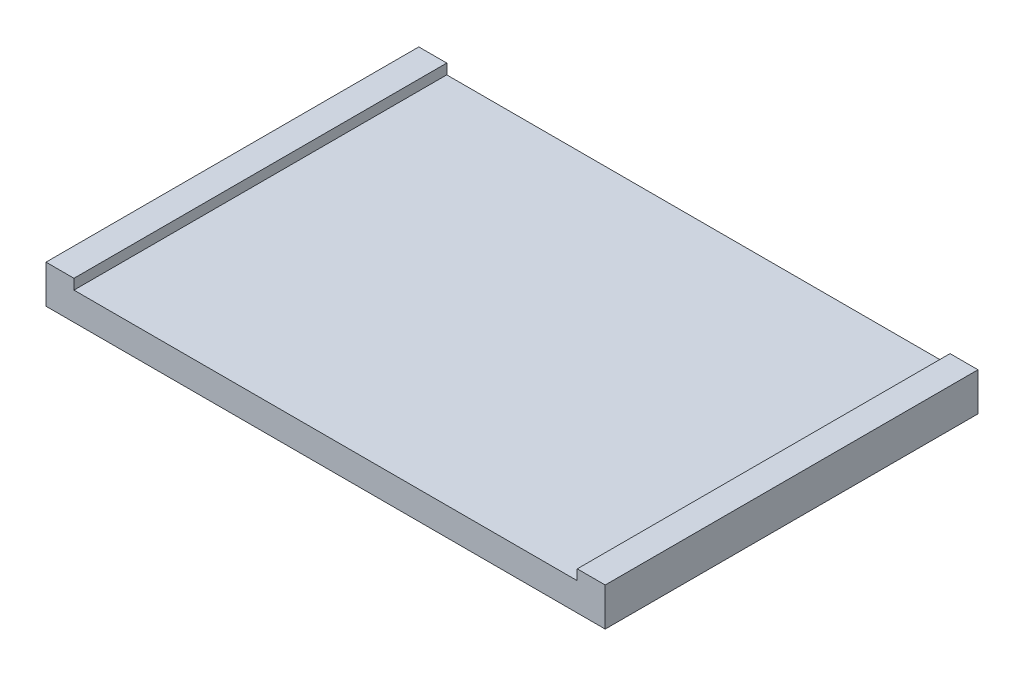
from build123d import *

# Parameters (mm, degrees)
SKETCH1_W           = 30
SKETCH1_H           = 20
BOSS_EXTRUDE1_DEPTH = 1.5
SKETCH2_W           = 1.5
SKETCH2_H           = 20
BOSS_EXTRUDE2_DEPTH = 0.55


with BuildPart() as part:
    # Sketch1 → Boss-Extrude1 (new body)
    with BuildSketch(Plane(origin=(0, 0, 0), x_dir=(1, 0, 0), z_dir=(0, 1, 0))):
        with Locations((15, 10)):
            Rectangle(SKETCH1_W, SKETCH1_H)
    extrude(amount=BOSS_EXTRUDE1_DEPTH)

    # Sketch2 → Boss-Extrude2 (add)
    with BuildSketch(Plane(origin=(0, 1.5, 0), x_dir=(1, 0, 0), z_dir=(0, 1, 0))):
        with Locations((0.75, 10)):
            Rectangle(SKETCH2_W, SKETCH2_H)
        with Locations((29.25, 10)):
            Rectangle(SKETCH2_W, SKETCH2_H)
    extrude(amount=BOSS_EXTRUDE2_DEPTH)


solid = part.part
